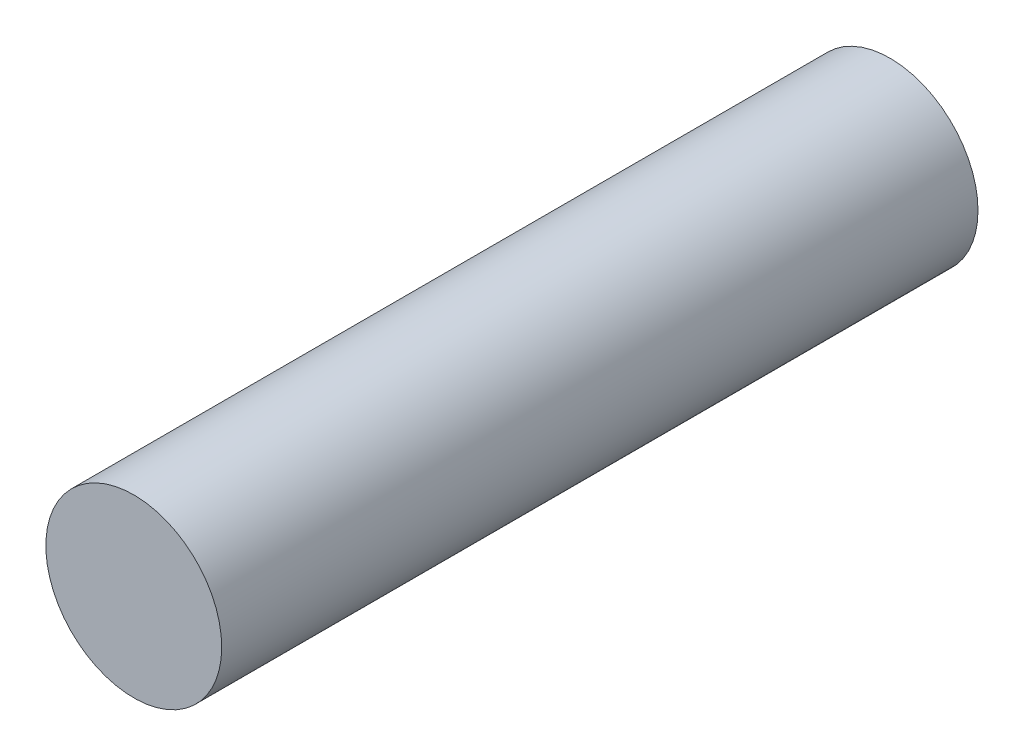
from build123d import *

# Parameters (mm, degrees)
SKETCH1_R           = 5
BOSS_EXTRUDE1_DEPTH = 43


with BuildPart() as part:
    # Sketch1 → Boss-Extrude1 (new body)
    with BuildSketch(Plane.XY):
        Circle(SKETCH1_R)
    extrude(amount=BOSS_EXTRUDE1_DEPTH)


solid = part.part
